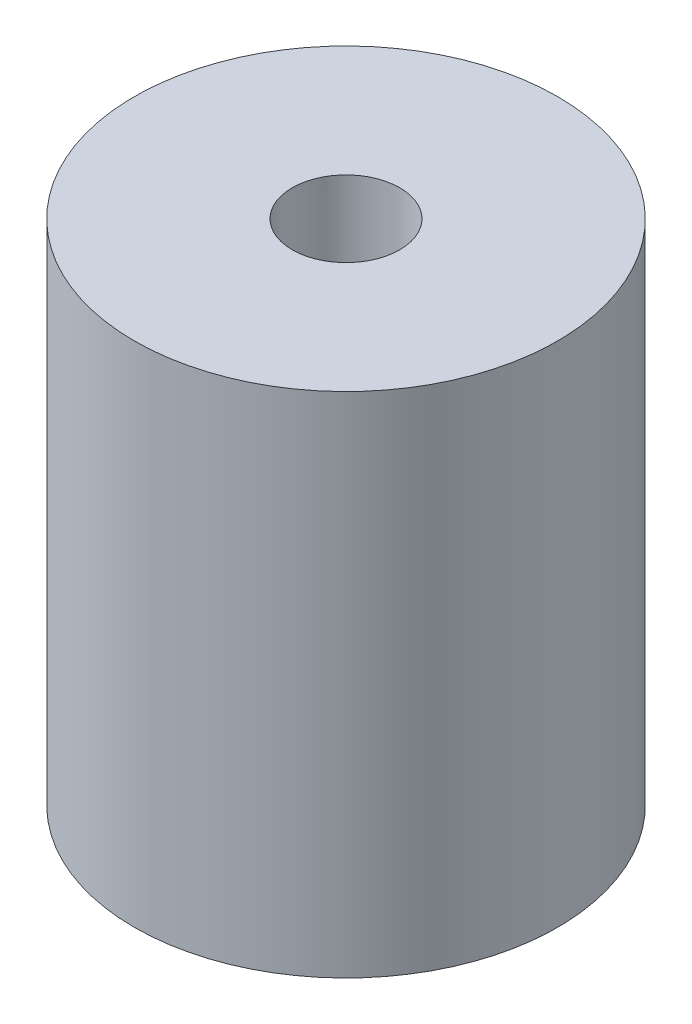
from build123d import *

# Parameters (mm, degrees)
SKETCH1_R           = 12.5
SKETCH1_R_2         = 3.175
BOSS_EXTRUDE1_DEPTH = 30
SKETCH2_R           = 6.35
CUT_EXTRUDE1_DEPTH  = 15


with BuildPart() as part:
    # Sketch1 → Boss-Extrude1 (new body)
    with BuildSketch(Plane(origin=(0, 0, 0), x_dir=(1, 0, 0), z_dir=(0, 1, 0))):
        with Locations(Location((0, 0, 0), (0, 0, 270))):
            Circle(SKETCH1_R)
        with Locations(Location((0, 0, 0), (0, 0, 270))):
            Circle(SKETCH1_R_2, mode=Mode.SUBTRACT)
    extrude(amount=BOSS_EXTRUDE1_DEPTH)

    # Sketch2 → Cut-Extrude1 (cut)
    with BuildSketch(Plane.XZ):
        with Locations(Location((0, 0, 0), (0, 0, 270))):
            Circle(SKETCH2_R)
    extrude(amount=-CUT_EXTRUDE1_DEPTH, mode=Mode.SUBTRACT)


solid = part.part
